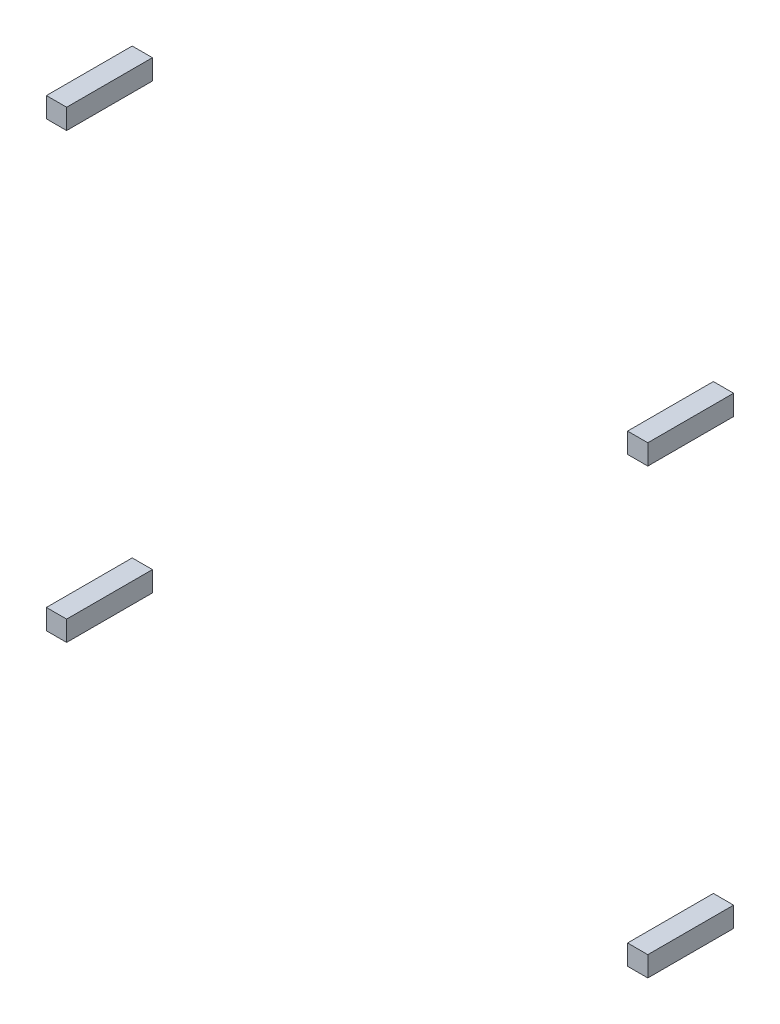
from build123d import *

# Parameters (mm, degrees)
SKETCH_1_W        = 0.707106782
SKETCH_1_H        = 0.707106782
EXTRUDE_1_DEPTH   = 3
EXTRUDE_1_2_DEPTH = 3
EXTRUDE_1_3_DEPTH = 3
EXTRUDE_1_4_DEPTH = 3


with BuildPart() as part:
    # 草图1 → 凸台-拉伸1 (new body)
    with BuildSketch(Plane.XY):
        with Locations((20.32, 0)):
            Rectangle(SKETCH_1_W, SKETCH_1_H)
    extrude(amount=EXTRUDE_1_DEPTH)


with BuildPart() as body_2:
    # 草图1 → Extrude 1 2 (new body)
    with BuildSketch(Plane.XY):
        Rectangle(SKETCH_1_W, SKETCH_1_H)
    extrude(amount=EXTRUDE_1_2_DEPTH)


with BuildPart() as body_3:
    # 草图1 → Extrude 1 3 (new body)
    with BuildSketch(Plane.XY):
        with Locations((20.32, 15.5)):
            Rectangle(SKETCH_1_W, SKETCH_1_H)
    extrude(amount=EXTRUDE_1_3_DEPTH)


with BuildPart() as body_4:
    # 草图1 → Extrude 1 4 (new body)
    with BuildSketch(Plane.XY):
        with Locations((0, 15.5)):
            Rectangle(SKETCH_1_W, SKETCH_1_H)
    extrude(amount=EXTRUDE_1_4_DEPTH)


solid = Compound([part.part, body_2.part, body_3.part, body_4.part])
